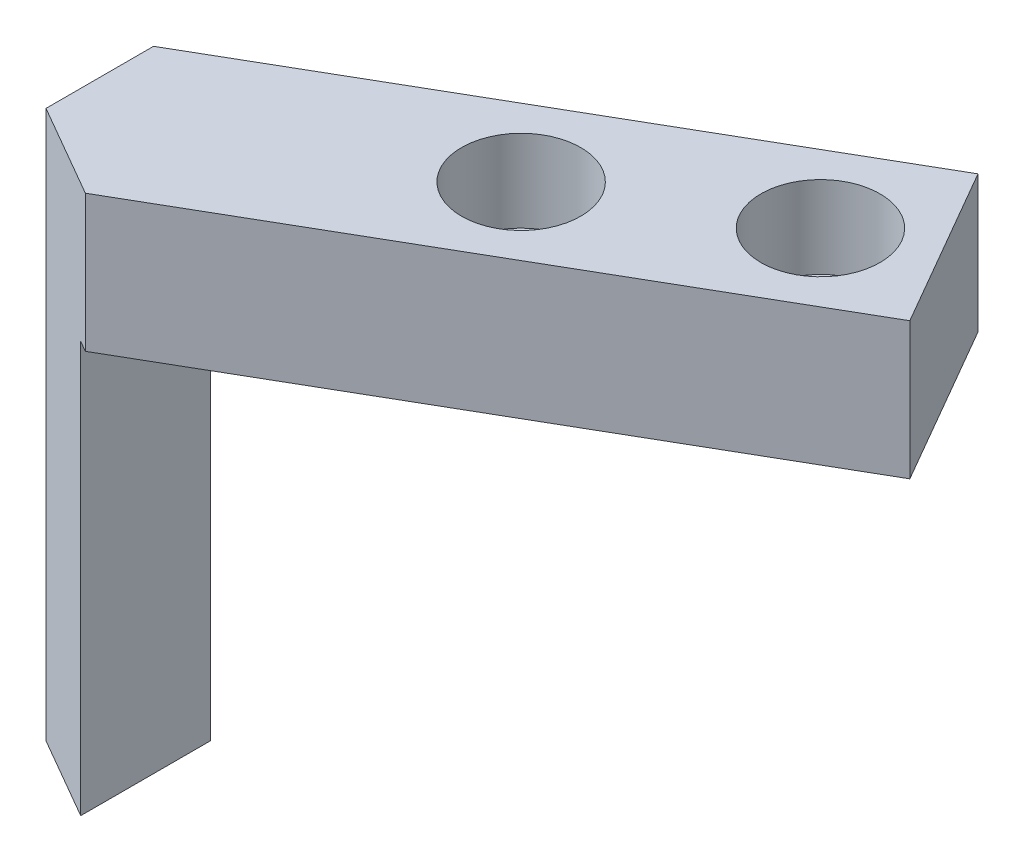
from build123d import *

# Parameters (mm, degrees)
EXTRUDE_1_DEPTH              = 5
EXTRUDE_2_DEPTH              = 15
HOLE_WIZARD_M2_1_D           = 2.35
HOLE_WIZARD_M2_1_DEPTH       = 20
HOLE_WIZARD_M2_1_CBORE_D     = 4.35
HOLE_WIZARD_M2_1_CBORE_DEPTH = 3


with BuildPart() as part:
    # 草圖1 → 填料-伸長1 (new body)
    with BuildSketch(Plane.XZ.offset(5)):
        Polygon((3.4, 1.962990915), (0, 0), (0, -3.92598183), (19.084609691, -14.944486373), (22.484609691, -9.055513627), align=None)
    extrude(amount=-EXTRUDE_1_DEPTH)

    # 草圖2 → 填料-伸長2 (add)
    with BuildSketch(Plane.XZ.offset(5)):
        Polygon((3, 1.732050808), (3, -2.997949192), (0, -2.997949192), (0, 0), align=None)
    extrude(amount=EXTRUDE_2_DEPTH)

    # M2 六角頭機械螺釘的柱孔1
    with Locations(Plane(origin=(0, 0, 0), x_dir=(1, 0, 0), z_dir=(0, 1, 0))):
        with Locations((17.926725858, 10.35), (10.998522628, 6.35)):
            CounterBoreHole(HOLE_WIZARD_M2_1_D / 2, HOLE_WIZARD_M2_1_CBORE_D / 2, HOLE_WIZARD_M2_1_CBORE_DEPTH, depth=HOLE_WIZARD_M2_1_DEPTH)


solid = part.part
